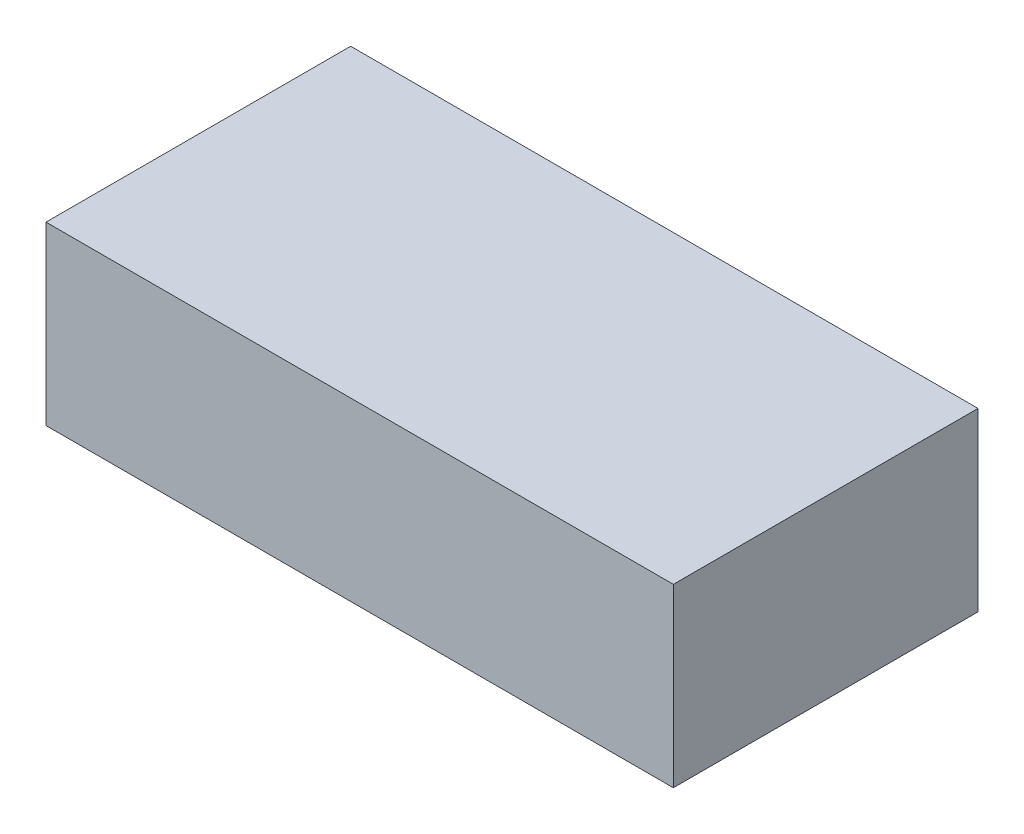
from build123d import *

# Parameters (mm, degrees)
SKETCH1_W           = 47.752
SKETCH1_H           = 23.1902
BOSS_EXTRUDE1_DEPTH = 13.4112


with BuildPart() as part:
    # Sketch1 → Boss-Extrude1 (new body)
    with BuildSketch(Plane(origin=(0, 0, 0), x_dir=(1, 0, 0), z_dir=(0, 1, 0))):
        with Locations((23.876, 11.5951)):
            Rectangle(SKETCH1_W, SKETCH1_H)
    extrude(amount=BOSS_EXTRUDE1_DEPTH)


solid = part.part
